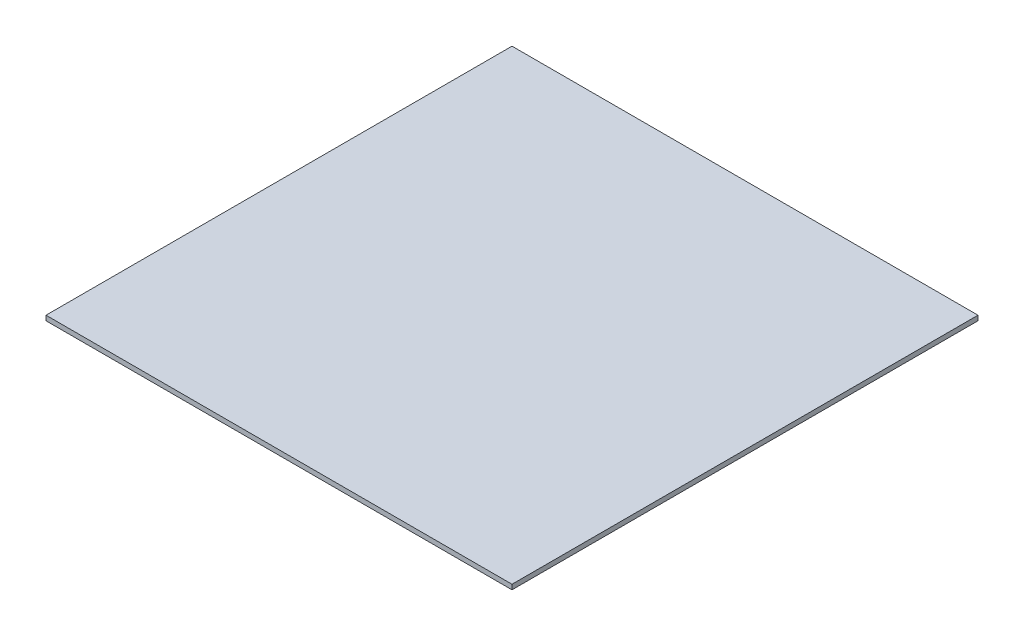
from build123d import *

# Parameters (mm, degrees)
SKETCH1_W           = 304.8
SKETCH1_H           = 304.8
BOSS_EXTRUDE1_DEPTH = 3.175


with BuildPart() as part:
    # Sketch1 → Boss-Extrude1 (new body)
    with BuildSketch(Plane(origin=(0, 0, 0), x_dir=(1, 0, 0), z_dir=(0, 1, 0))):
        with Locations((107.778561524, 120.763636213)):
            Rectangle(SKETCH1_W, SKETCH1_H)
    extrude(amount=BOSS_EXTRUDE1_DEPTH)


solid = part.part
